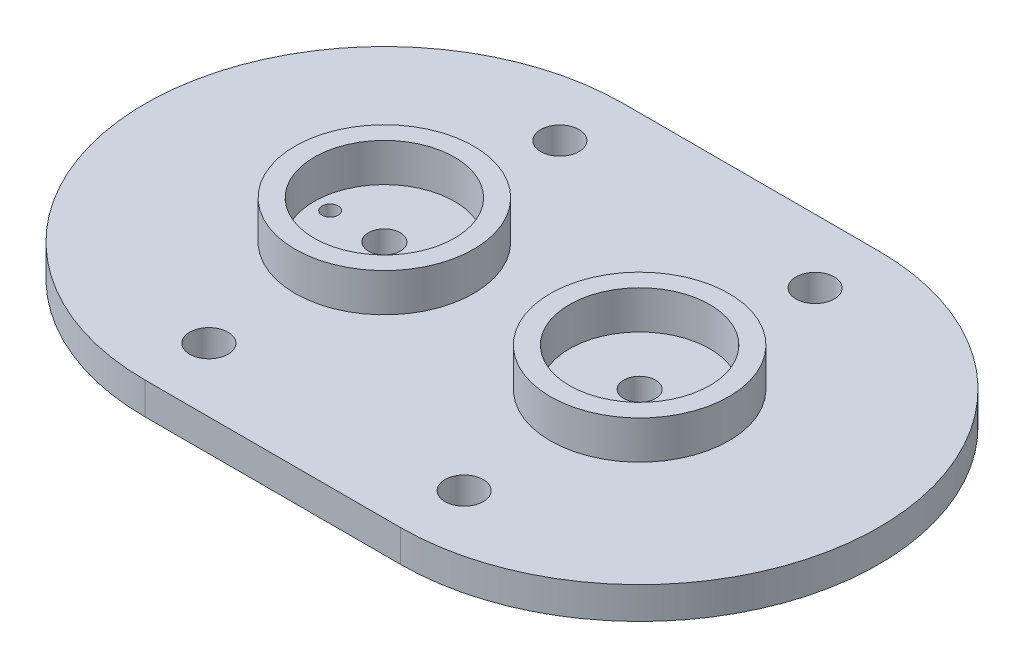
from build123d import *

# Parameters (mm, degrees)
SALIENTE_EXTRUIR1_DEPTH = 2.5
CROQUIS2_R              = 14
CROQUIS2_R_2            = 11
SALIENTE_EXTRUIR2_DEPTH = 6
CROQUIS8_R              = 15
CROQUIS8_R_2            = 3.75
SALIENTE_EXTRUIR4_DEPTH = 2.5
REDONDEO2_R             = 1
CORTAR_EXTRUIR1_REACH   = 71.056
CROQUIS6_R              = 1.265
CROQUIS6_R_2            = 2.5
CROQUIS6_R_3            = 3


with BuildPart() as part:
    # Croquis1 → Saliente-Extruir1 (new, symmetric)
    with BuildSketch(Plane(origin=(0, 0, 0), x_dir=(1, 0, 0), z_dir=(0, 1, 0))):
        with BuildLine():
            Line((-20, 37.5), (20, 37.5))
            ThreePointArc((20, 37.5), (57.5, 0), (20, -37.5))
            Line((20, -37.5), (-20, -37.5))
            ThreePointArc((-20, -37.5), (-57.5, 0), (-20, 37.5))
        make_face()
    extrude(amount=SALIENTE_EXTRUIR1_DEPTH, both=True)

    # Croquis2 → Saliente-Extruir2 (add)
    # profile 1 of 2: a face of its own
    with BuildSketch(Plane(origin=(0, 2.5, 0), x_dir=(1, 0, 0), z_dir=(0, 1, 0))):
        with Locations(Location((-20, 0, 0), (0, 0, 270))):
            Circle(CROQUIS2_R)
        with Locations(Location((-20, 0, 0), (0, 0, 270))):
            Circle(CROQUIS2_R_2, mode=Mode.SUBTRACT)
    # profile 2 of 2: a face of its own
    with BuildSketch(Plane(origin=(0, 2.5, 0), x_dir=(1, 0, 0), z_dir=(0, 1, 0))):
        with Locations(Location((20, 0, 0), (0, 0, 270))):
            Circle(CROQUIS2_R)
        with Locations(Location((20, 0, 0), (0, 0, 270))):
            Circle(CROQUIS2_R_2, mode=Mode.SUBTRACT)
    extrude(amount=SALIENTE_EXTRUIR2_DEPTH)

    # Croquis8 → Saliente-Extruir4 (add)
    with BuildSketch(Plane.XZ.offset(2.5)):
        with Locations(Location((-20, 0, 0), (0, 0, 270))):
            Circle(CROQUIS8_R)
        with Locations(Location((-20, 0, 0), (0, 0, 270))):
            Circle(CROQUIS8_R_2, mode=Mode.SUBTRACT)
    extrude(amount=SALIENTE_EXTRUIR4_DEPTH)

    # Redondeo2
    redondeo2_edges = [part.edges().sort_by_distance(p)[0] for p in [
        (-20, -2.5, 15),
        (-20, -5, 15),
    ]]
    fillet(redondeo2_edges, radius=REDONDEO2_R)

    # Croquis6 → Cortar-Extruir1 (cut, up to next)
    with BuildSketch(Plane(origin=(0, 2.5, 0), x_dir=(1, 0, 0), z_dir=(0, 1, 0)), mode=Mode.PRIVATE) as cortar_extruir1_sk1:
        with Locations(Location((-28.5, 0, 0), (0, 0, 270))):
            Circle(CROQUIS6_R)
    cortar_extruir1_tool1 = extrude(cortar_extruir1_sk1.sketch, amount=-CORTAR_EXTRUIR1_REACH, mode=Mode.PRIVATE) & part.part
    # Croquis6 → Cortar-Extruir1 (cut, up to next)
    with BuildSketch(Plane(origin=(0, 2.5, 0), x_dir=(1, 0, 0), z_dir=(0, 1, 0)), mode=Mode.PRIVATE) as cortar_extruir1_sk2:
        with Locations(Location((-11.5, 0, 0), (0, 0, 270))):
            Circle(CROQUIS6_R)
    cortar_extruir1_tool2 = extrude(cortar_extruir1_sk2.sketch, amount=-CORTAR_EXTRUIR1_REACH, mode=Mode.PRIVATE) & part.part
    # Croquis6 → Cortar-Extruir1 (cut, up to next)
    with BuildSketch(Plane(origin=(0, 2.5, 0), x_dir=(1, 0, 0), z_dir=(0, 1, 0)), mode=Mode.PRIVATE) as cortar_extruir1_sk3:
        with Locations(Location((-20, 0, 0), (0, 0, 270))):
            Circle(CROQUIS6_R_2)
    cortar_extruir1_tool3 = extrude(cortar_extruir1_sk3.sketch, amount=-CORTAR_EXTRUIR1_REACH, mode=Mode.PRIVATE) & part.part
    # Croquis6 → Cortar-Extruir1 (cut, up to next)
    with BuildSketch(Plane(origin=(0, 2.5, 0), x_dir=(1, 0, 0), z_dir=(0, 1, 0)), mode=Mode.PRIVATE) as cortar_extruir1_sk4:
        with Locations(Location((20, 0, 0), (0, 0, 270))):
            Circle(CROQUIS6_R_2)
    cortar_extruir1_tool4 = extrude(cortar_extruir1_sk4.sketch, amount=-CORTAR_EXTRUIR1_REACH, mode=Mode.PRIVATE) & part.part
    # Croquis6 → Cortar-Extruir1 (cut, up to next)
    with BuildSketch(Plane(origin=(0, 2.5, 0), x_dir=(1, 0, 0), z_dir=(0, 1, 0)), mode=Mode.PRIVATE) as cortar_extruir1_sk5:
        with Locations(Location((-20, 27.5, 0), (0, 0, 270))):
            Circle(CROQUIS6_R_3)
    cortar_extruir1_tool5 = extrude(cortar_extruir1_sk5.sketch, amount=-CORTAR_EXTRUIR1_REACH, mode=Mode.PRIVATE) & part.part
    # Croquis6 → Cortar-Extruir1 (cut, up to next)
    with BuildSketch(Plane(origin=(0, 2.5, 0), x_dir=(1, 0, 0), z_dir=(0, 1, 0)), mode=Mode.PRIVATE) as cortar_extruir1_sk6:
        with Locations(Location((20, 27.5, 0), (0, 0, 270))):
            Circle(CROQUIS6_R_3)
    cortar_extruir1_tool6 = extrude(cortar_extruir1_sk6.sketch, amount=-CORTAR_EXTRUIR1_REACH, mode=Mode.PRIVATE) & part.part
    # Croquis6 → Cortar-Extruir1 (cut, up to next)
    with BuildSketch(Plane(origin=(0, 2.5, 0), x_dir=(1, 0, 0), z_dir=(0, 1, 0)), mode=Mode.PRIVATE) as cortar_extruir1_sk7:
        with Locations(Location((20, -27.5, 0), (0, 0, 270))):
            Circle(CROQUIS6_R_3)
    cortar_extruir1_tool7 = extrude(cortar_extruir1_sk7.sketch, amount=-CORTAR_EXTRUIR1_REACH, mode=Mode.PRIVATE) & part.part
    # Croquis6 → Cortar-Extruir1 (cut, up to next)
    with BuildSketch(Plane(origin=(0, 2.5, 0), x_dir=(1, 0, 0), z_dir=(0, 1, 0)), mode=Mode.PRIVATE) as cortar_extruir1_sk8:
        with Locations(Location((-20, -27.5, 0), (0, 0, 270))):
            Circle(CROQUIS6_R_3)
    cortar_extruir1_tool8 = extrude(cortar_extruir1_sk8.sketch, amount=-CORTAR_EXTRUIR1_REACH, mode=Mode.PRIVATE) & part.part
    add(cortar_extruir1_tool1.solids().sort_by_distance((-28.5, 2.5, 0))[0], mode=Mode.SUBTRACT)
    add(cortar_extruir1_tool2.solids().sort_by_distance((-11.5, 2.5, 0))[0], mode=Mode.SUBTRACT)
    add(cortar_extruir1_tool3.solids().sort_by_distance((-20, 2.5, 0))[0], mode=Mode.SUBTRACT)
    add(cortar_extruir1_tool4.solids().sort_by_distance((20, 2.5, 0))[0], mode=Mode.SUBTRACT)
    add(cortar_extruir1_tool5.solids().sort_by_distance((-20, 2.5, -27.5))[0], mode=Mode.SUBTRACT)
    add(cortar_extruir1_tool6.solids().sort_by_distance((20, 2.5, -27.5))[0], mode=Mode.SUBTRACT)
    add(cortar_extruir1_tool7.solids().sort_by_distance((20, 2.5, 27.5))[0], mode=Mode.SUBTRACT)
    add(cortar_extruir1_tool8.solids().sort_by_distance((-20, 2.5, 27.5))[0], mode=Mode.SUBTRACT)


solid = part.part
